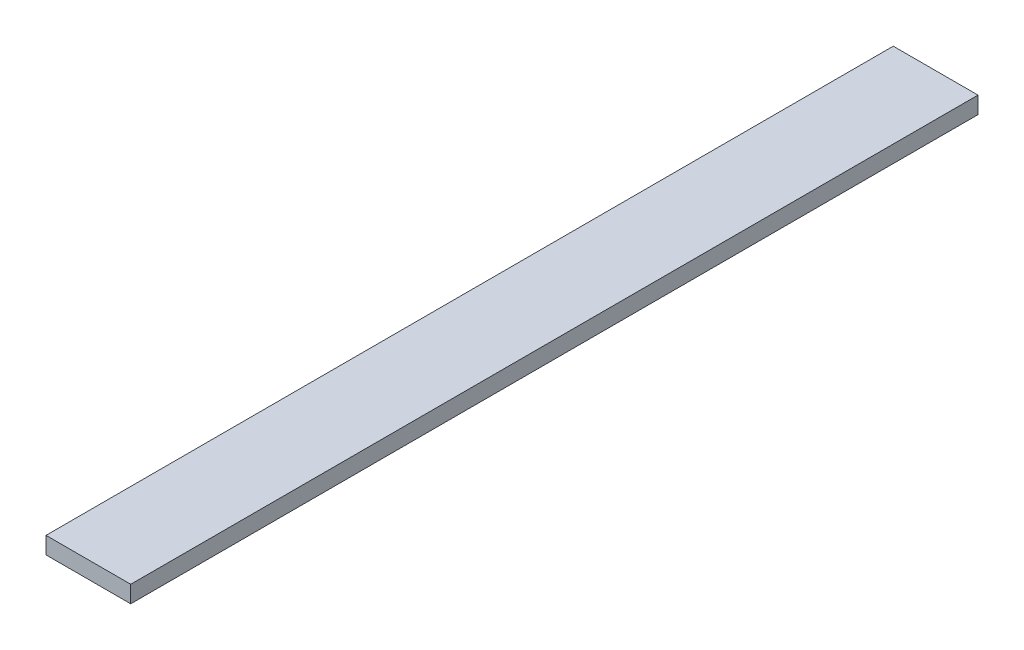
from build123d import *

# Parameters (mm, degrees)
SKETCH1_W           = 25
SKETCH1_H           = 250
BOSS_EXTRUDE1_DEPTH = 5


with BuildPart() as part:
    # Sketch1 → Boss-Extrude1 (new body)
    with BuildSketch(Plane(origin=(0, 0, 0), x_dir=(1, 0, 0), z_dir=(0, 1, 0))):
        with Locations((12.5, 125)):
            Rectangle(SKETCH1_W, SKETCH1_H)
    extrude(amount=BOSS_EXTRUDE1_DEPTH)


solid = part.part
